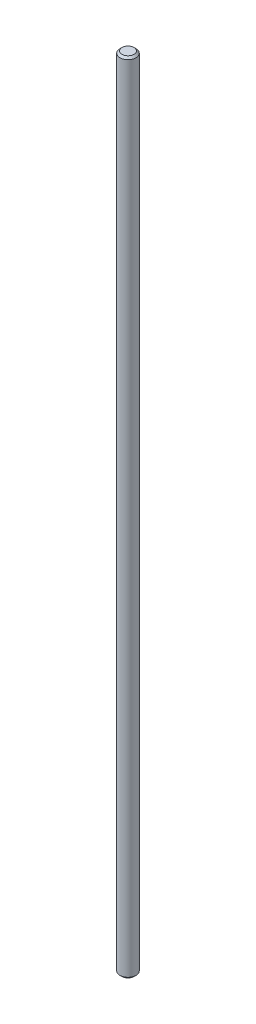
from build123d import *

# Parameters (mm, degrees)
SKETCH1_R           = 4
BOSS_EXTRUDE1_DEPTH = 400
CHAMFER1_SIZE       = 1


with BuildPart() as part:
    # Sketch1 → Boss-Extrude1 (new body)
    with BuildSketch(Plane(origin=(0, 0, 0), x_dir=(1, 0, 0), z_dir=(0, 1, 0))):
        with Locations(Location((0, 0, 0), (0, 0, 270))):
            Circle(SKETCH1_R)
    extrude(amount=BOSS_EXTRUDE1_DEPTH)

    # Chamfer1
    chamfer1_edges = [part.edges().sort_by_distance(p)[0] for p in [
        (0, 0, -4),
        (0, 400, -4),
    ]]
    chamfer(chamfer1_edges, length=CHAMFER1_SIZE)


solid = part.part
